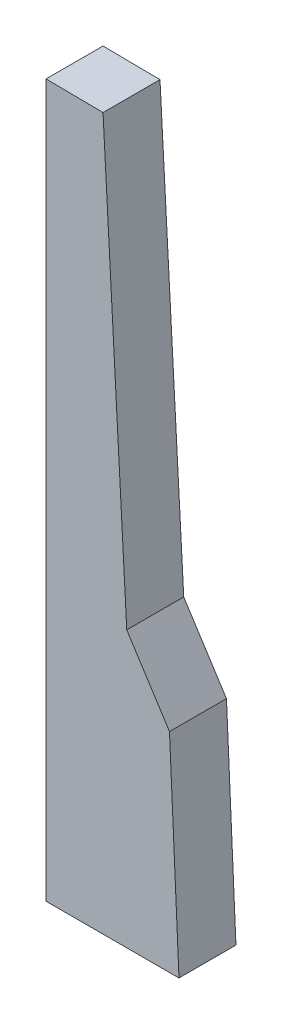
from build123d import *

# Parameters (mm, degrees)
BOSS_EXTRUDE1_DEPTH = 6


with BuildPart() as part:
    # Sketch1 → Boss-Extrude1 (new body)
    with BuildSketch(Plane.XY):
        Polygon((0, 0), (0, 75), (5.999614586, 74.931994), (8.5, 29), (13, 21.977260976), (14, 0), align=None)
    extrude(amount=BOSS_EXTRUDE1_DEPTH)


solid = part.part
